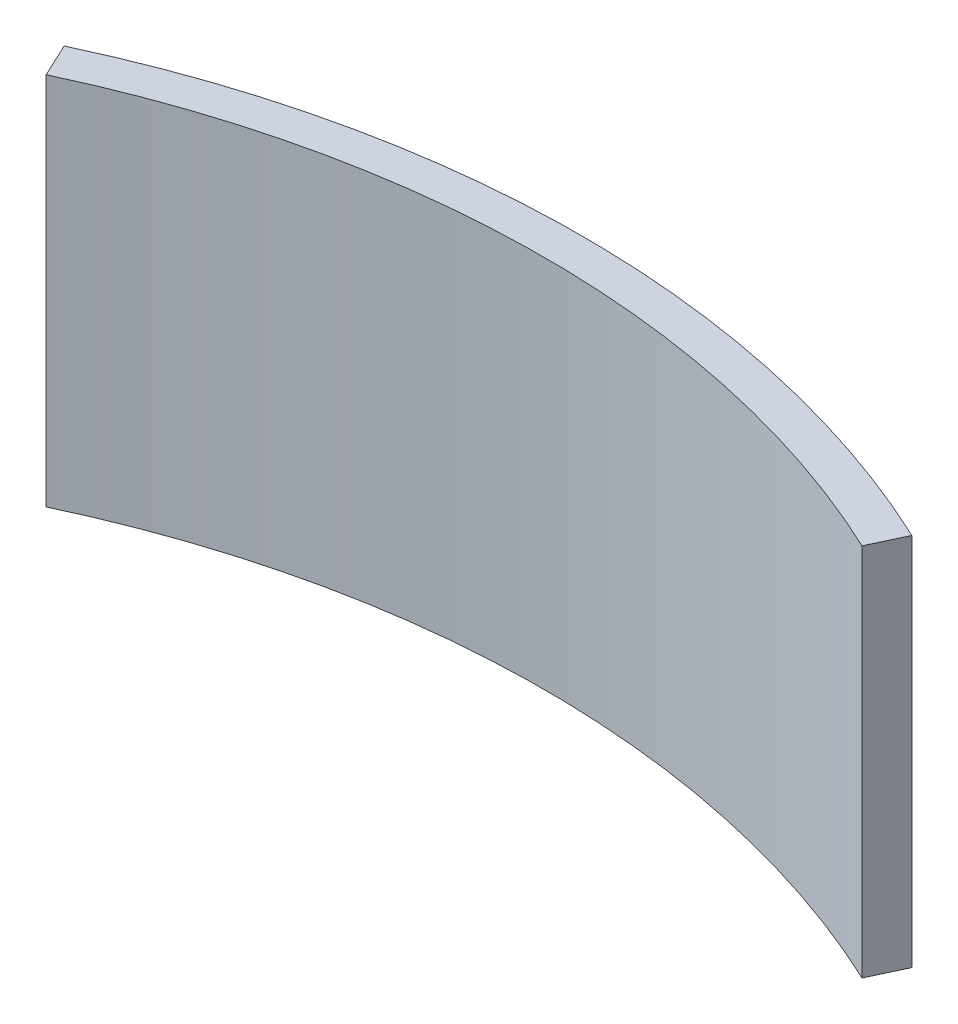
from build123d import *

# Parameters (mm, degrees)
BOSS_EXTRUDE1_DEPTH = 30


with BuildPart() as part:
    # Sketch1 → Boss-Extrude1 (new body)
    with BuildSketch(Plane(origin=(0, 0, 0), x_dir=(1, 0, 0), z_dir=(0, 1, 0))):
        with BuildLine():
            Line((33.974232351, 72.427560612), (32.700198638, 69.711527089))
            ThreePointArc((32.700198638, 69.711527089), (0, 77), (-32.700198638, 69.711527089))
            Line((-32.700198638, 69.711527089), (-33.974232351, 72.427560612))
            ThreePointArc((-33.974232351, 72.427560612), (0, 80), (33.974232351, 72.427560612))
        make_face()
    extrude(amount=BOSS_EXTRUDE1_DEPTH)


solid = part.part
